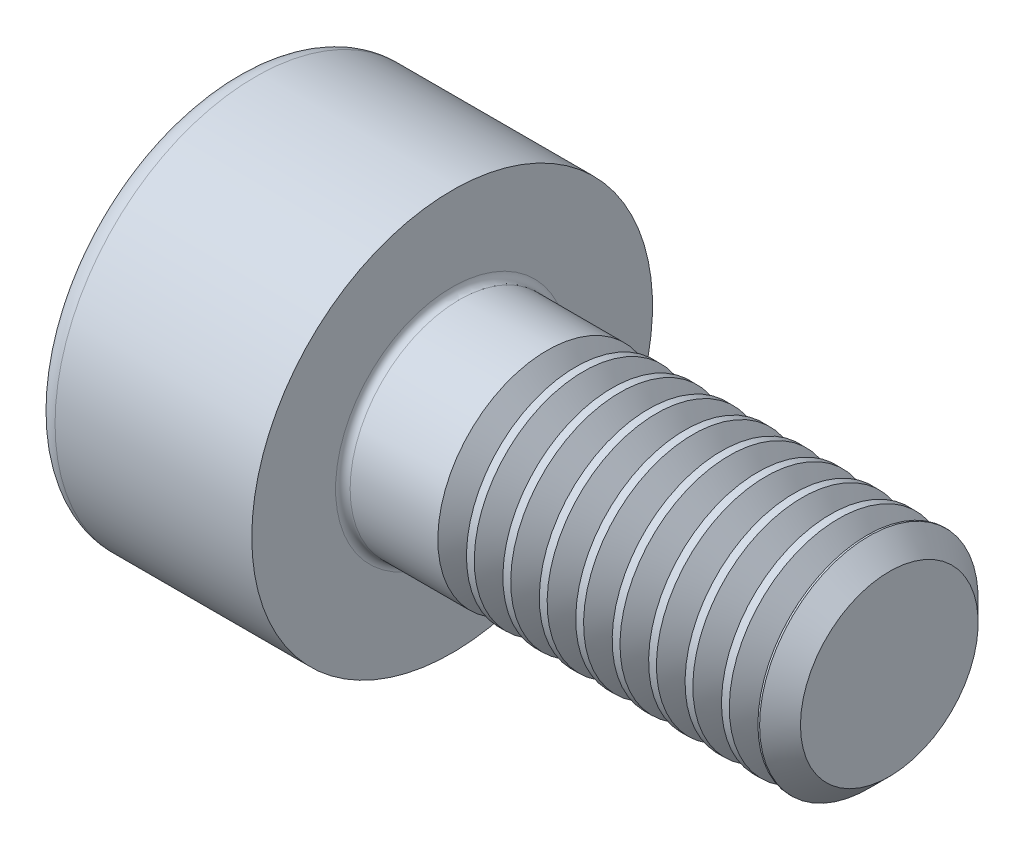
from build123d import *

# Parameters (mm, degrees)
FILLET1_R       = 0.1
FILLET2_R       = 0.3
HEX_2_DEPTH     = 1.3
THDSCHPAT_COUNT = 9
THDSCHPAT_PITCH = 0.5


with BuildPart() as part:
    # BodySke → Base-Revolve (revolve)
    with BuildSketch(Plane.XY, mode=Mode.PRIVATE) as base_revolve_sk:
        Polygon((0, 0), (0, 2.75), (3, 2.75), (3, 1.5), (8.7195, 1.5), (9, 1.2195), (9, 0), align=None)
    revolve(base_revolve_sk.sketch.rotate(Axis((-31.75, 0, 0), (1, 0, 0)), 90), axis=Axis((-31.75, 0, 0), (1, 0, 0)))

    # Fillet1
    fillet1_edges = [part.edges().sort_by_distance(p)[0] for p in [
        (3, 0, -1.5),
    ]]
    fillet(fillet1_edges, radius=FILLET1_R)

    # Fillet2
    fillet2_edges = [part.edges().sort_by_distance(p)[0] for p in [
        (0, 0, -2.75),
    ]]
    fillet(fillet2_edges, radius=FILLET2_R)

    # Sketch2 → Hex-PreBroach (revolve, cut)
    with BuildSketch(Plane.XY, mode=Mode.PRIVATE) as hex_prebroach_sk:
        Polygon((0, 1.26), (1.3, 1.26), (2.027461339, 0), (0, 0), align=None)
    revolve(hex_prebroach_sk.sketch.rotate(Axis((0, 0, 0), (1, 0, 0)), 90), axis=Axis((0, 0, 0), (1, 0, 0)), mode=Mode.SUBTRACT)

    # Sketch3 → Hex 2 (cut)
    with BuildSketch(Plane(origin=(0, 0, 0), x_dir=(0, 0.500000000000001, 0.866025403784438), z_dir=(-1, 0, 0))):
        Polygon((0.727461339, 1.26), (-0.727461339, 1.26), (-1.454922678, 0), (-0.727461339, -1.26), (0.727461339, -1.26), (1.454922678, 0), align=None)
    extrude(amount=-HEX_2_DEPTH, mode=Mode.SUBTRACT)

    # ThdSchSke → ThreadSchematic (revolve, cut)
    with BuildSketch(Plane.XY):
        Polygon((4.5, -1.2195), (4.303591786, -1.5), (4.303591786, -1.875), (4.696408214, -1.875), (4.696408214, -1.5), align=None)
    threadschematic = revolve(axis=Axis((-3.175, 0, 0), (1, 0, 0)), mode=Mode.SUBTRACT)

    # ThdSchPat: ThreadSchematic ×9
    with Locations(*[(i * THDSCHPAT_PITCH, 0, 0) for i in range(1, THDSCHPAT_COUNT)]):
        add(threadschematic, mode=Mode.SUBTRACT)


solid = part.part
